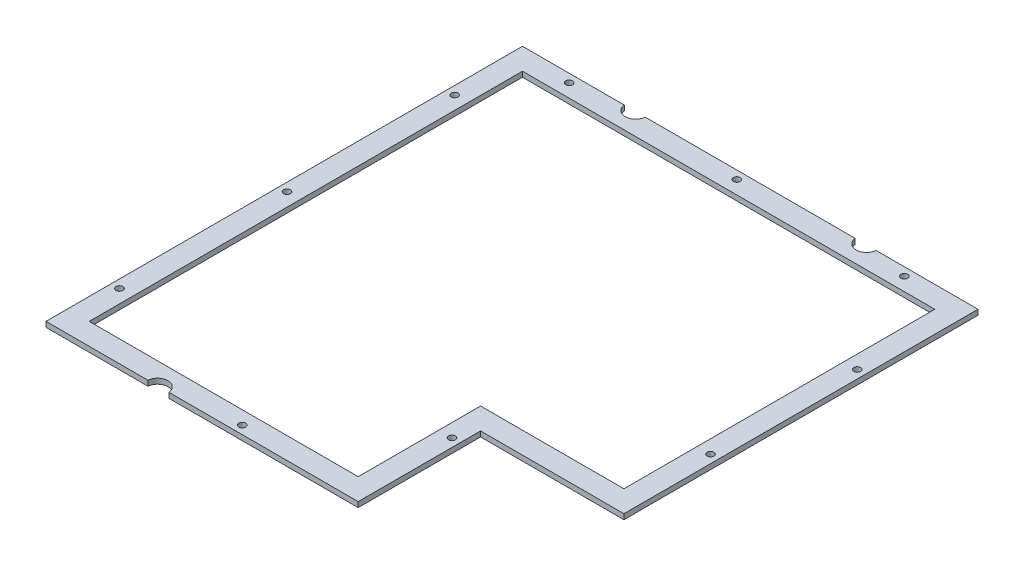
from build123d import *

# Parameters (mm, degrees)
EXTRUDE1_DEPTH = 3.175
SKETCH2_R      = 2.0701
EXTRUDE2_DEPTH = 200.886360684
SKETCH3_R      = 6.35
EXTRUDE3_DEPTH = 200.886360684


with BuildPart() as part:
    # Sketch1 → Extrude1 (new body)
    with BuildSketch(Plane(origin=(0, 0, 0), x_dir=(1, 0, 0), z_dir=(0, 1, 0))):
        Polygon((-138.1125, 144.4625), (138.1125, 144.4625), (138.1125, -70.2437), (51.1937, -70.2437), (51.1937, -144.4625), (-138.1125, -144.4625), align=None)
        Polygon((-125.0188, 131.3688), (125.0188, 131.3688), (125.0188, -57.15), (38.1, -57.15), (38.1, -131.3688), (-125.0188, -131.3688), align=None, mode=Mode.SUBTRACT)
    extrude(amount=EXTRUDE1_DEPTH)

    # Sketch2 → Extrude2 (cut, through all)
    with BuildSketch(Plane(origin=(0, 3.175, 0), x_dir=(-1, 0, 0), z_dir=(0, 1, 0))):
        with Locations(Location((24.13, 139.446, 0), (0, 0, 90))):
            Circle(SKETCH2_R)
        with Locations(Location((104.775, -139.446, 0), (0, 0, 90))):
            Circle(SKETCH2_R)
        with Locations(Location((3.175, -139.446, 0), (0, 0, 90))):
            Circle(SKETCH2_R)
        with Locations(Location((133.096, 104.9365694, 0), (0, 0, 90))):
            Circle(SKETCH2_R)
        with Locations(Location((133.096, 3.3365694, 0), (0, 0, 90))):
            Circle(SKETCH2_R)
        with Locations(Location((133.096, -98.2634306, 0), (0, 0, 90))):
            Circle(SKETCH2_R)
        with Locations(Location((-98.425, -139.446, 0), (0, 0, 90))):
            Circle(SKETCH2_R)
        with Locations(Location((-133.096, -76.2, 0), (0, 0, 90))):
            Circle(SKETCH2_R)
        with Locations(Location((-133.096, 12.7, 0), (0, 0, 90))):
            Circle(SKETCH2_R)
        with Locations(Location((-46.1772, 82.55, 0), (0, 0, 90))):
            Circle(SKETCH2_R)
    extrude(amount=-EXTRUDE2_DEPTH, mode=Mode.SUBTRACT)

    # Sketch3 → Extrude3 (cut, through all)
    with BuildSketch(Plane(origin=(0, 3.175, 0), x_dir=(-1, 0, 0), z_dir=(0, 1, 0))):
        with Locations((69.99986, 145.00098)):
            Circle(SKETCH3_R)
        with Locations((69.99986, -145.00098)):
            Circle(SKETCH3_R)
        with Locations((-69.99986, -145.00098)):
            Circle(SKETCH3_R)
    extrude(amount=-EXTRUDE3_DEPTH, mode=Mode.SUBTRACT)


solid = part.part
